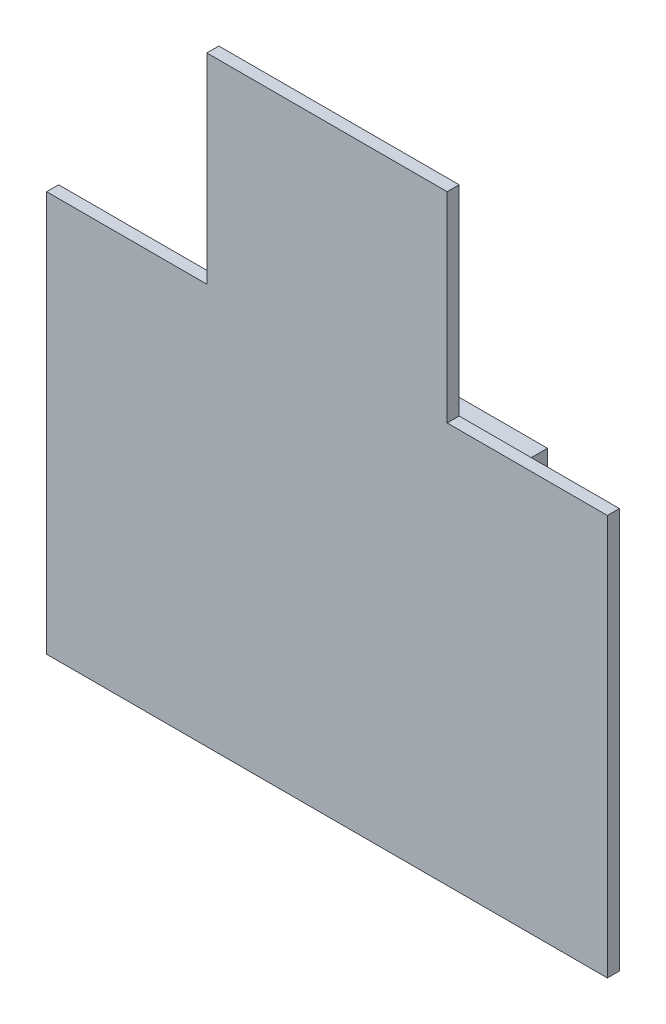
from build123d import *

# Parameters (mm, degrees)
SKETCH_1_W      = 140
SKETCH_1_H      = 100
EXTRUDE_1_DEPTH = 3
SKETCH_2_W      = 60
SKETCH_2_H      = 3
EXTRUDE_2_DEPTH = 50
SKETCH_3_W      = 64.075246498
SKETCH_3_H      = 68.106213914
EXTRUDE_3_DEPTH = 20
SKETCH_4_R      = 7.433229746
EXTRUDE_4_DEPTH = 10


with BuildPart() as part:
    # 草图1 → 凸台-拉伸1 (new body)
    with BuildSketch(Plane.XY):
        Rectangle(SKETCH_1_W, SKETCH_1_H)
    extrude(amount=EXTRUDE_1_DEPTH)

    # 草图2 → 凸台-拉伸2 (add)
    with BuildSketch(Plane(origin=(0, 50, 0), x_dir=(1, 0, 0), z_dir=(0, 1, 0))):
        with Locations((0, -1.5)):
            Rectangle(SKETCH_2_W, SKETCH_2_H)
    extrude(amount=EXTRUDE_2_DEPTH)

    # 草图3 → 凸台-拉伸3 (add)
    with BuildSketch(Plane(origin=(0, 0, 0), x_dir=(-1, 0, 0), z_dir=(0, 0, -1))):
        Rectangle(SKETCH_3_W, SKETCH_3_H)
    extrude(amount=EXTRUDE_3_DEPTH)

    # 草图4 → 凸台-拉伸4 (add)
    with BuildSketch(Plane(origin=(0, 0, -20), x_dir=(-1, 0, 0), z_dir=(0, 0, -1))):
        with Locations(Location((17.874179181, 0, 0), (0, 0, 180))):
            Circle(SKETCH_4_R)
        with Locations(Location((-15.837302871, 0, 0), (0, 0, 180))):
            Circle(SKETCH_4_R)
    extrude(amount=EXTRUDE_4_DEPTH)


solid = part.part
